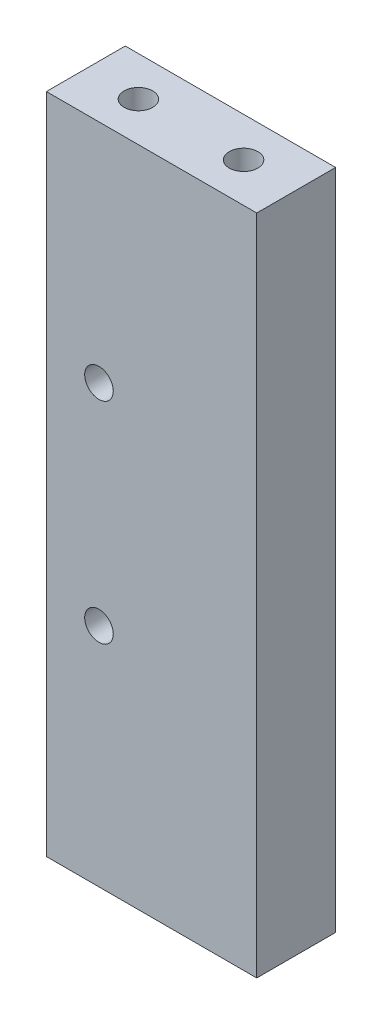
from build123d import *

# Parameters (mm, degrees)
SKETCH1_W                 = 25.4
SKETCH1_H                 = 9.525
BOSS_EXTRUDE1_DEPTH       = 80
F_8_32_TAPPED_HOLE1_D     = 3.4544
F_8_32_TAPPED_HOLE1_DEPTH = 19.05
F_8_32_TAPPED_HOLE1_TIP   = 1.037806461
F_8_32_TAPPED_HOLE2_D     = 3.4544
F_8_32_TAPPED_HOLE2_DEPTH = 20.066
F_8_32_TAPPED_HOLE2_TIP   = 1.037806461
F_8_32_TAPPED_HOLE3_D     = 3.4544


with BuildPart() as part:
    # Sketch1 → Boss-Extrude1 (new body)
    with BuildSketch(Plane(origin=(0, 0, 0), x_dir=(1, 0, 0), z_dir=(0, 1, 0))):
        with Locations((-14.638893842, 4.7625)):
            Rectangle(SKETCH1_W, SKETCH1_H)
    extrude(amount=BOSS_EXTRUDE1_DEPTH)

    # #8-32 Tapped Hole1
    with Locations(Plane(origin=(0, 80, 0), x_dir=(1, 0, 0), z_dir=(0, 1, 0))):
        with Locations((-8.288893842, 4.7625), (-20.988893842, 4.7625)):
            Hole(F_8_32_TAPPED_HOLE1_D / 2, depth=F_8_32_TAPPED_HOLE1_DEPTH)
            with Locations((0, 0, -(F_8_32_TAPPED_HOLE1_DEPTH + F_8_32_TAPPED_HOLE1_TIP / 2))):  # 118° drill point
                Cone(0, F_8_32_TAPPED_HOLE1_D / 2, F_8_32_TAPPED_HOLE1_TIP, mode=Mode.SUBTRACT)

    # #8-32 Tapped Hole2
    with Locations(Plane(origin=(0, 0, 0), x_dir=(-1, 0, 0), z_dir=(0, -1, 0))):
        with Locations((20.988893842, 4.7625), (8.288893842, 4.7625)):
            Hole(F_8_32_TAPPED_HOLE2_D / 2, depth=F_8_32_TAPPED_HOLE2_DEPTH)
            with Locations((0, 0, -(F_8_32_TAPPED_HOLE2_DEPTH + F_8_32_TAPPED_HOLE2_TIP / 2))):  # 118° drill point
                Cone(0, F_8_32_TAPPED_HOLE2_D / 2, F_8_32_TAPPED_HOLE2_TIP, mode=Mode.SUBTRACT)

    # #8-32 Tapped Hole3 (through all)
    with Locations(Plane.XY):
        with Locations((-20.988893842, 52.705), (-20.988893842, 27.305)):
            Hole(F_8_32_TAPPED_HOLE3_D / 2)


solid = part.part
